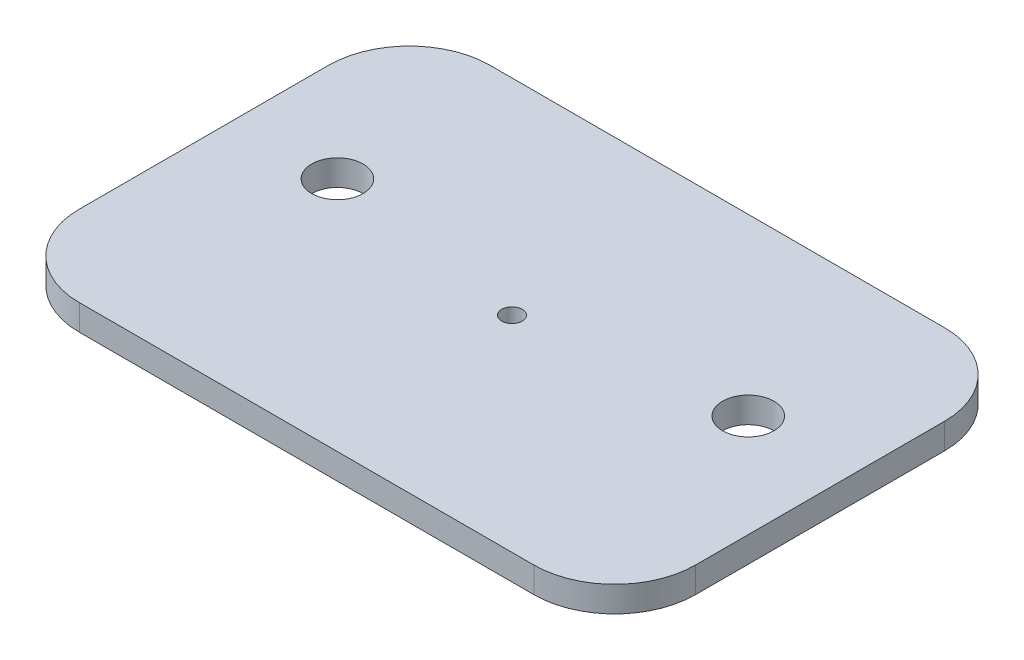
from build123d import *

# Parameters (mm, degrees)
SKETCH1_W           = 76.2
SKETCH1_H           = 50.8
SKETCH1_R           = 3.175
SKETCH1_R_2         = 1.27
BOSS_EXTRUDE1_DEPTH = 3.175
FILLET1_R           = 10


with BuildPart() as part:
    # Sketch1 → Boss-Extrude1 (new body)
    with BuildSketch(Plane(origin=(0, 0, 0), x_dir=(1, 0, 0), z_dir=(0, 1, 0))):
        Rectangle(SKETCH1_W, SKETCH1_H)
        with Locations(Location((-25.4, 3.81, 0), (0, 0, 270))):
            Circle(SKETCH1_R, mode=Mode.SUBTRACT)
        with Locations(Location((25.4, 3.81, 0), (0, 0, 270))):
            Circle(SKETCH1_R, mode=Mode.SUBTRACT)
        with Locations(Location((0, 0, 0), (0, 0, 270))):
            Circle(SKETCH1_R_2, mode=Mode.SUBTRACT)
    extrude(amount=BOSS_EXTRUDE1_DEPTH)

    # Fillet1
    fillet1_edges = [part.edges().sort_by_distance(p)[0] for p in [
        (38.1, 1.5875, 25.4),
        (-38.1, 1.5875, 25.4),
        (-38.1, 1.5875, -25.4),
        (38.1, 1.5875, -25.4),
    ]]
    fillet(fillet1_edges, radius=FILLET1_R)


solid = part.part
